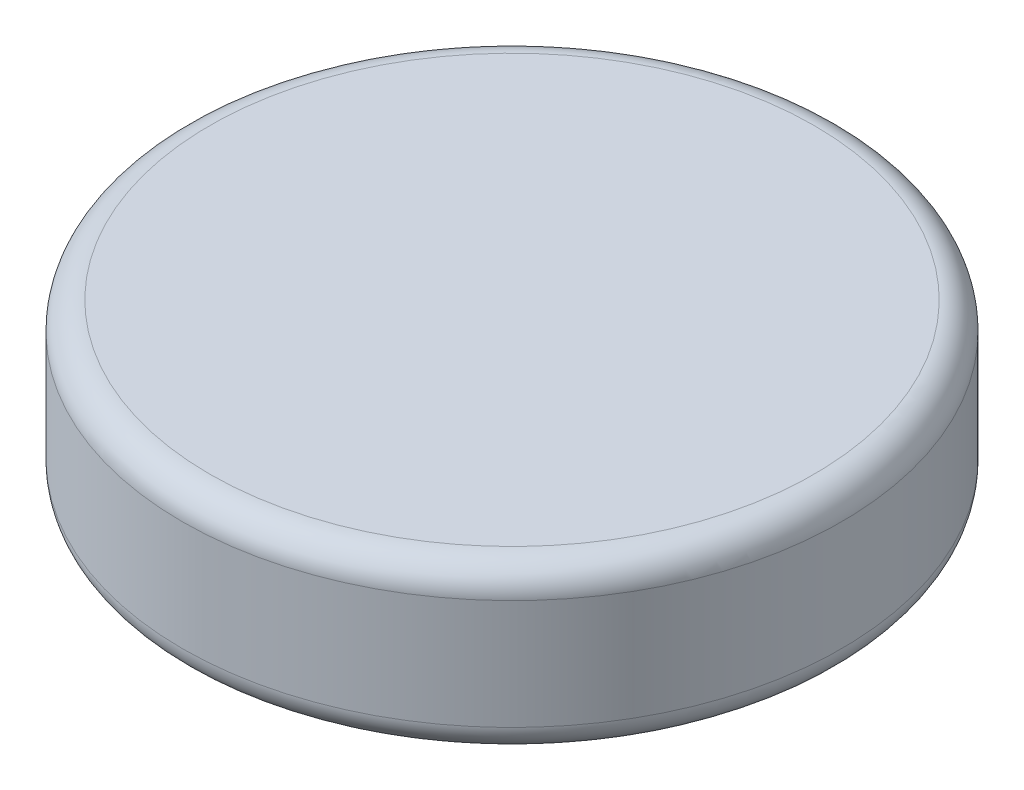
from build123d import *

# Parameters (mm, degrees)
SKETCH1_R           = 5.9995
BOSS_EXTRUDE1_DEPTH = 3
FILLET1_R           = 0.5


with BuildPart() as part:
    # Sketch1 → Boss-Extrude1 (new body)
    with BuildSketch(Plane(origin=(0, 0, 0), x_dir=(1, 0, 0), z_dir=(0, 1, 0))):
        with Locations(Location((0, 0, 0), (0, 0, 270))):
            Circle(SKETCH1_R)
    extrude(amount=BOSS_EXTRUDE1_DEPTH)

    # Fillet1
    fillet1_edges = [part.edges().sort_by_distance(p)[0] for p in [
        (0, 0, -5.9995),
        (0, 3, -5.9995),
    ]]
    fillet(fillet1_edges, radius=FILLET1_R)


solid = part.part
